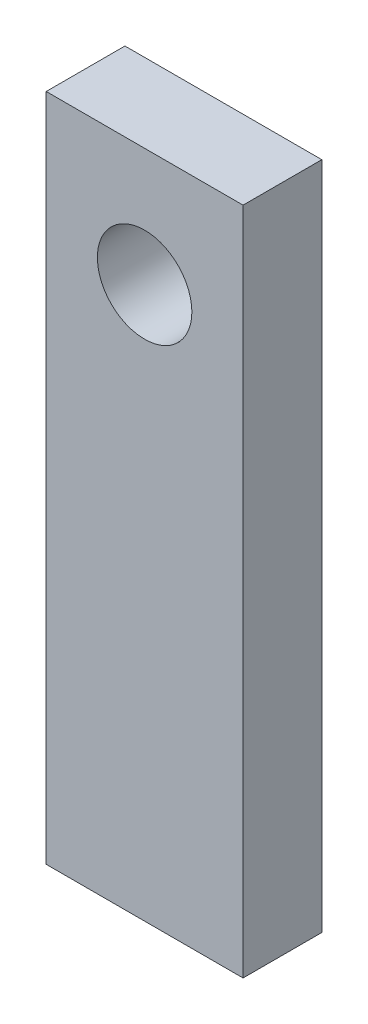
from build123d import *

# Parameters (mm, degrees)
SKETCH_1_W          = 25
SKETCH_1_H          = 10
EXTRUDE_1_DEPTH     = 85
SKETCH_2_R          = 6
CUT_EXTRUDE_1_DEPTH = 90.162772501
M3X0_5_1_D          = 2.5
M3X0_5_1_DEPTH      = 11.5
M3X0_5_1_TIP        = 0.751075774


with BuildPart() as part:
    # ｽｹｯﾁ1 → ﾎﾞｽ - 押し出し1 (new body)
    with BuildSketch(Plane(origin=(0, 0, 0), x_dir=(1, 0, 0), z_dir=(0, 1, 0))):
        with Locations((12.5, 5)):
            Rectangle(SKETCH_1_W, SKETCH_1_H)
    extrude(amount=EXTRUDE_1_DEPTH)

    # ｽｹｯﾁ2 → ｶｯﾄ - 押し出し1 (cut, through all)
    with BuildSketch(Plane.XY):
        with Locations((12.5, 70)):
            Circle(SKETCH_2_R)
    extrude(amount=-CUT_EXTRUDE_1_DEPTH, mode=Mode.SUBTRACT)

    # M3x0.5 ねじ穴1
    with Locations(Plane.XZ):
        with Locations((20, -5), (5, -5)):
            Hole(M3X0_5_1_D / 2, depth=M3X0_5_1_DEPTH)
            with Locations((0, 0, -(M3X0_5_1_DEPTH + M3X0_5_1_TIP / 2))):  # 118° drill point
                Cone(0, M3X0_5_1_D / 2, M3X0_5_1_TIP, mode=Mode.SUBTRACT)


solid = part.part
